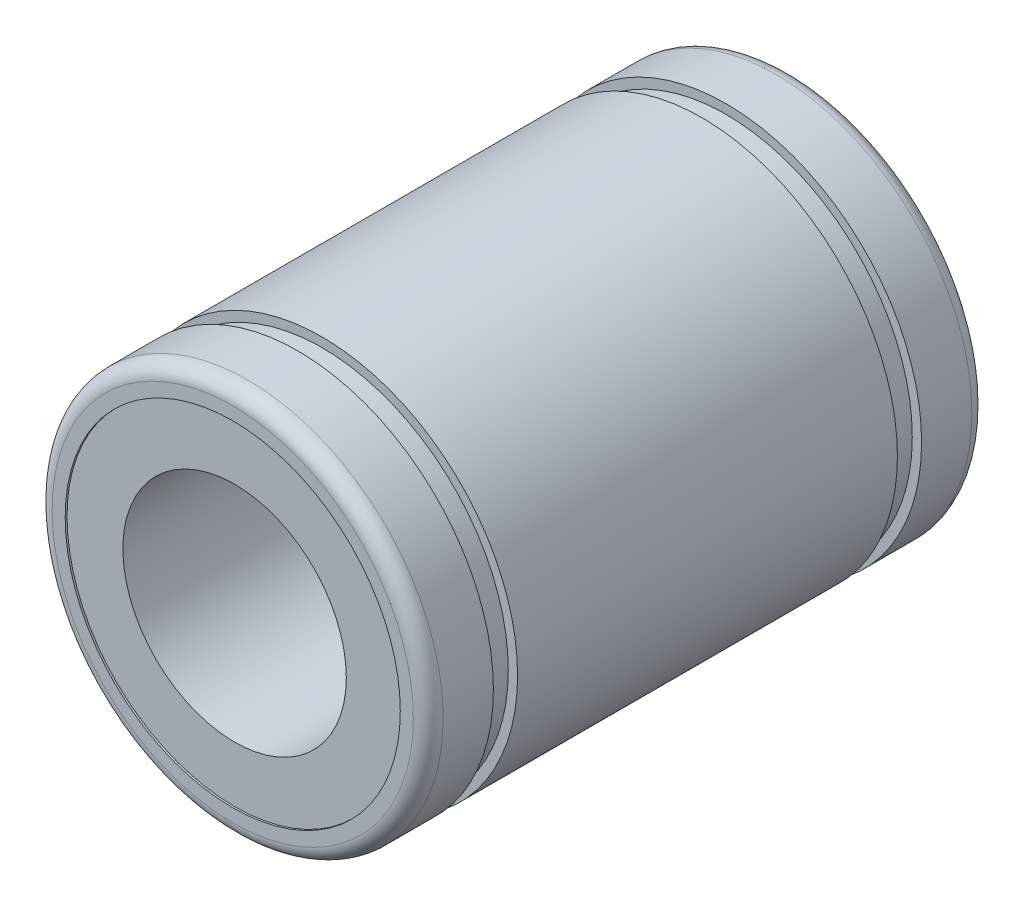
from build123d import *

# Parameters (mm, degrees)
ESBO_O2_R             = 9
CORTE_EXTRUS_O1_DEPTH = 0.1
CORTE_EXTRUS_O2_START = -0.1
ESBO_O3_R             = 9
CORTE_EXTRUS_O2_DEPTH = 0.1


with BuildPart() as part:
    # Esboço1 → Revolução1 (revolve)
    with BuildSketch(Plane(origin=(0, 0, 0), x_dir=(1, 0, 0), z_dir=(0, 1, 0))):
        with BuildLine():
            Line((9.7, -3), (6, -3))
            Line((6, -3), (6, -33))
            Line((6, -33), (9.7, -33))
            ThreePointArc((9.7, -33), (10.265685425, -32.765685425), (10.5, -32.2))
            Line((10.5, -32.2), (10.5, -29.5))
            Line((10.5, -29.5), (10, -29.5))
            Line((10, -29.5), (10, -28.2))
            Line((10, -28.2), (10.5, -28.2))
            Line((10.5, -28.2), (10.5, -7.8))
            Line((10.5, -7.8), (10, -7.8))
            Line((10, -7.8), (10, -6.5))
            Line((10, -6.5), (10.5, -6.5))
            Line((10.5, -6.5), (10.5, -3.8))
            ThreePointArc((10.5, -3.8), (10.265685425, -3.234314575), (9.7, -3))
        make_face()
    revolve(axis=Axis((0, 0, 2.998746006), (0, 0, 1)))

    # Esboço2 → Corte-extrusão1 (cut)
    with BuildSketch(Plane.XY.offset(33)):
        Circle(ESBO_O2_R)
    extrude(amount=-CORTE_EXTRUS_O1_DEPTH, mode=Mode.SUBTRACT)

    # Esboço3 → Corte-extrusão2 (cut)
    with BuildSketch(Plane(origin=(0, 0, 3), x_dir=(-1, 0, 0), z_dir=(0, 0, -1)).offset(CORTE_EXTRUS_O2_START)):
        with Locations(Location((0, 0, 0), (0, 0, 180))):
            Circle(ESBO_O3_R)
    extrude(amount=CORTE_EXTRUS_O2_DEPTH, mode=Mode.SUBTRACT)


solid = part.part
